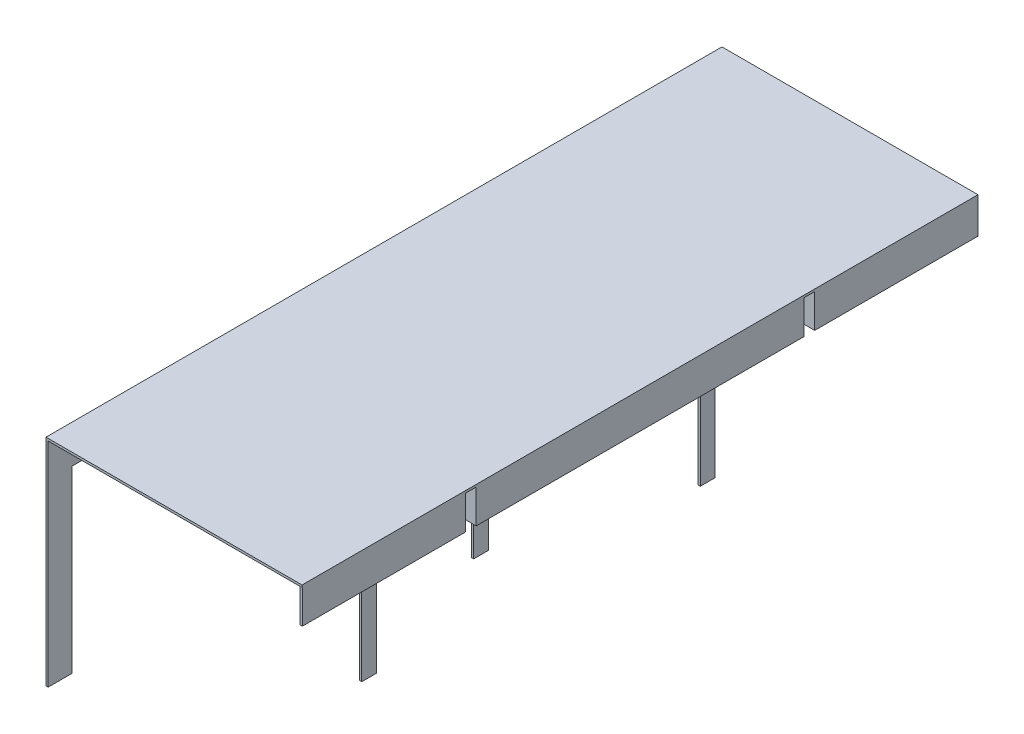
from build123d import *

# Parameters (mm, degrees)
BOSS_EXTRUDE1_DEPTH = 304.8
SKETCH2_W           = 2174.24
SKETCH2_H           = 5740.4
BOSS_EXTRUDE2_DEPTH = 19.05
BOSS_EXTRUDE3_DEPTH = 285.75
SKETCH4_W           = 19.05
SKETCH4_H           = 127
BOSS_EXTRUDE4_DEPTH = 1524
SKETCH5_W           = 19.05
SKETCH5_H           = 2286
BOSS_EXTRUDE5_DEPTH = 152.4
SKETCH6_W           = 19.05
SKETCH6_H           = 1524
BOSS_EXTRUDE6_DEPTH = 5740.4
SKETCH7_W           = 5111.75
SKETCH7_H           = 1524
CUT_EXTRUDE1_DEPTH  = 6442.508732875


with BuildPart() as part:
    # Sketch1 → Boss-Extrude1 (new body)
    with BuildSketch(Plane(origin=(0, 0, 0), x_dir=(1, 0, 0), z_dir=(0, 1, 0))):
        Polygon((0, 0), (0, 1386.84), (-863.6, 1386.84), (-863.6, 1475.74), (0, 1475.74), (0, 4262.12), (-863.6, 4262.12), (-863.6, 4351.02), (0, 4351.02), (0, 5737.86), (-889, 5737.86), (-889, 5718.81), (-19.05, 5718.81), (-19.05, 4370.07), (-882.65, 4370.07), (-882.65, 4243.07), (-19.05, 4243.07), (-19.05, 1494.79), (-882.65, 1494.79), (-882.65, 1367.79), (-19.05, 1367.79), (-19.05, 0), align=None)
    extrude(amount=BOSS_EXTRUDE1_DEPTH)

    # Sketch2 → Boss-Extrude2 (add)
    with BuildSketch(Plane(origin=(0, 304.8, 0), x_dir=(1, 0, 0), z_dir=(0, 1, 0))):
        with Locations((-1087.12, 2867.66)):
            Rectangle(SKETCH2_W, SKETCH2_H)
    extrude(amount=-BOSS_EXTRUDE2_DEPTH)

    # Sketch3 → Boss-Extrude3 (add)
    with BuildSketch(Plane.XZ.offset(-285.75)):
        Polygon((-2174.24, 2.54), (-2174.24, -2766.06), (-1310.64, -2766.06), (-1310.64, -2854.96), (-2174.24, -2854.96), (-2174.24, -5737.86), (-2155.19, -5737.86), (-2155.19, -2874.01), (-1291.59, -2874.01), (-1291.59, -2747.01), (-2155.19, -2747.01), (-2155.19, 2.54), align=None)
    extrude(amount=BOSS_EXTRUDE3_DEPTH)

    # Sketch4 → Boss-Extrude4 (add)
    with BuildSketch(Plane.XZ):
        with Locations((-873.125, -1431.29)):
            Rectangle(SKETCH4_W, SKETCH4_H)
        with Locations((-1301.115, -2810.51)):
            Rectangle(SKETCH4_W, SKETCH4_H)
        with Locations((-873.125, -4306.57)):
            Rectangle(SKETCH4_W, SKETCH4_H)
    extrude(amount=BOSS_EXTRUDE4_DEPTH)

    # Sketch5 → Boss-Extrude5 (add)
    with BuildSketch(Plane(origin=(-2155.19, 0, 0), x_dir=(0, 0, -1), z_dir=(1, 0, 0))):
        with Locations((5728.335, -838.2)):
            Rectangle(SKETCH5_W, SKETCH5_H)
    extrude(amount=BOSS_EXTRUDE5_DEPTH)

    # Sketch6 → Boss-Extrude6 (add)
    with BuildSketch(Plane(origin=(0, 0, -5737.86), x_dir=(-1, 0, 0), z_dir=(0, 0, -1))):
        with Locations((2164.715, -762)):
            Rectangle(SKETCH6_W, SKETCH6_H)
    extrude(amount=-BOSS_EXTRUDE6_DEPTH)

    # Sketch7 → Cut-Extrude1 (cut, through all)
    with BuildSketch(Plane(origin=(-2155.19, 0, 0), x_dir=(0, 0, -1), z_dir=(1, 0, 0))):
        with Locations((2756.535, -762)):
            Rectangle(SKETCH7_W, SKETCH7_H)
    extrude(amount=-CUT_EXTRUDE1_DEPTH, mode=Mode.SUBTRACT)


solid = part.part
